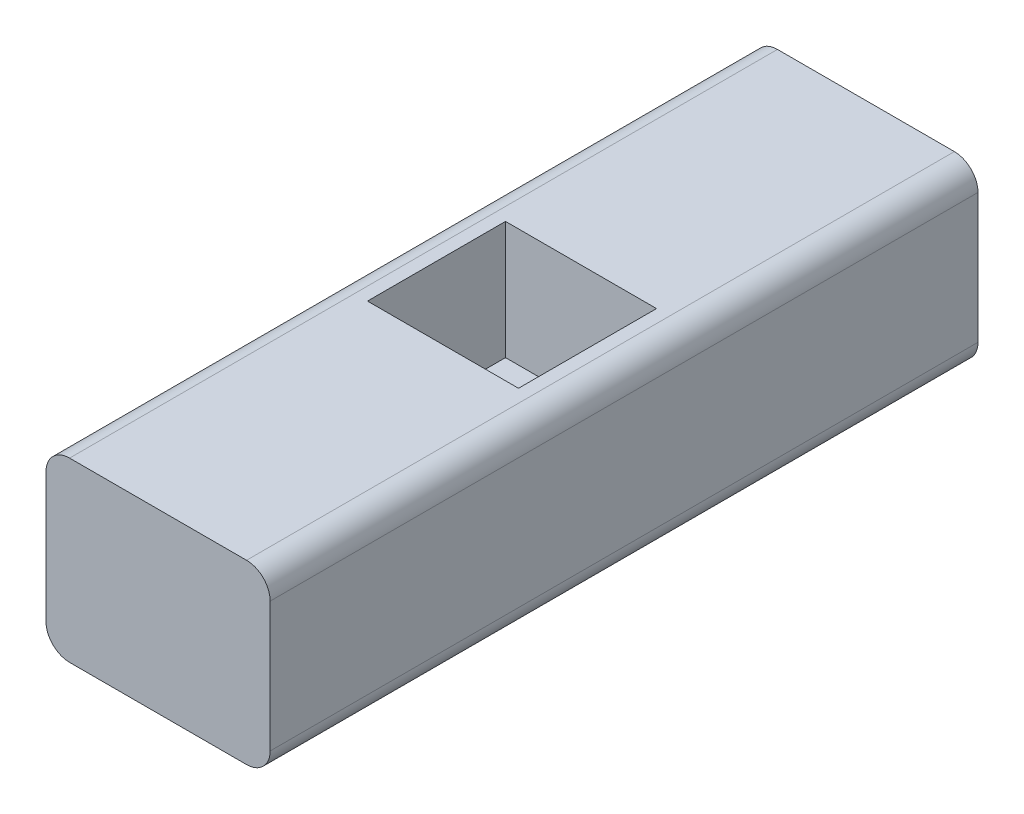
from build123d import *

# Parameters (mm, degrees)
BOSS_EXTRUDE2_DEPTH     = 120
CUT_EXTRUDE1_DEPTH      = 12.8
CUT_EXTRUDE1_DEPTH_BACK = 12.8
SKETCH5_W               = 23.4
SKETCH5_H               = 29


with BuildPart() as part:
    # Sketch4 → Boss-Extrude2 (new body)
    with BuildSketch(Plane.XY):
        with BuildLine():
            Line((-15, -15), (15, -15))
            ThreePointArc((15, -15), (17.828427125, -13.828427125), (19, -11))
            Line((19, -11), (19, 11))
            ThreePointArc((19, 11), (17.828427125, 13.828427125), (15, 15))
            Line((15, 15), (-15, 15))
            ThreePointArc((-15, 15), (-17.828427125, 13.828427125), (-19, 11))
            Line((-19, 11), (-19, -11))
            ThreePointArc((-19, -11), (-17.828427125, -13.828427125), (-15, -15))
        make_face()
    extrude(amount=BOSS_EXTRUDE2_DEPTH)

    # Sketch5 → Cut-Extrude1 (cut, two sides: drawn at the far end of the back side and taken through both)
    with BuildSketch(Plane(origin=(0, 0, 0), x_dir=(0, 0, -1), z_dir=(1, 0, 0)).offset(-CUT_EXTRUDE1_DEPTH_BACK)):
        with Locations((-60, 9.5)):
            Rectangle(SKETCH5_W, SKETCH5_H)
    extrude(amount=CUT_EXTRUDE1_DEPTH + CUT_EXTRUDE1_DEPTH_BACK, mode=Mode.SUBTRACT)


solid = part.part
